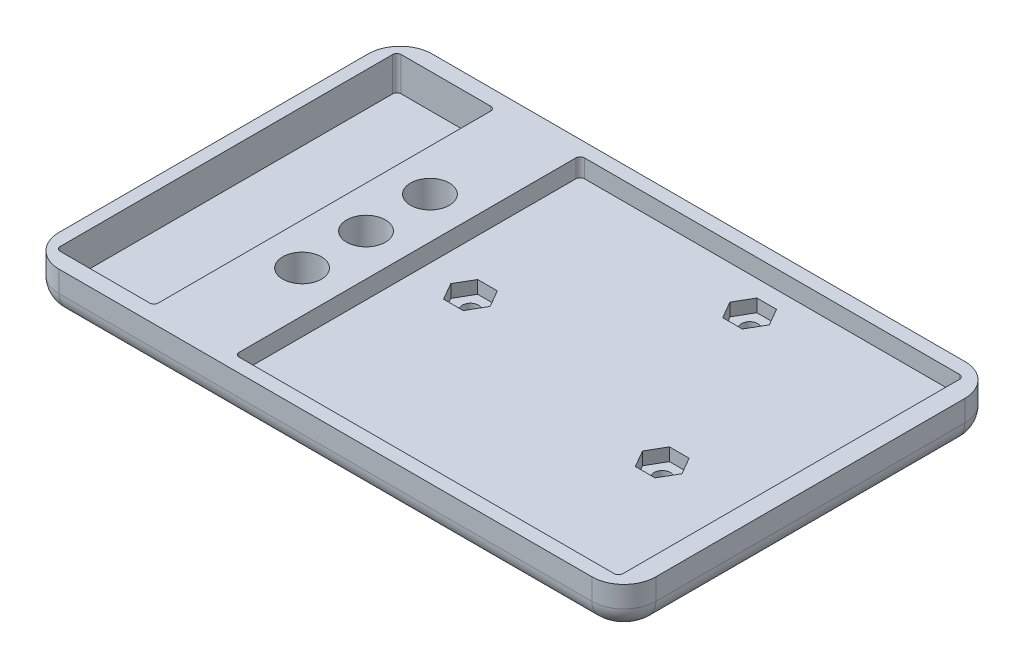
from build123d import *

# Parameters (mm, degrees)
SKETCH1_W             = 140
SKETCH1_H             = 87.5
BOSS_EXTRUDE1_DEPTH   = 10
SKETCH2_W             = 90
SKETCH2_H             = 81
CUT_EXTRUDE1_DEPTH    = 4.25
SKETCH5_W             = 23
SKETCH5_H             = 80
CUT_EXTRUDE2_DEPTH    = 8
F_6_CLEARANCE_HOLE1_D = 3.7973
CUT_EXTRUDE4_DEPTH    = 3
FILLET1_R             = 7.5
SKETCH15_R            = 4.55
CUT_EXTRUDE3_DEPTH    = 7.5
FILLET2_R             = 1
FILLET3_R             = 5


with BuildPart() as part:
    # Sketch1 → Boss-Extrude1 (new body)
    with BuildSketch(Plane(origin=(0, 0, 0), x_dir=(1, 0, 0), z_dir=(0, 1, 0))):
        with Locations((70, 43.75)):
            Rectangle(SKETCH1_W, SKETCH1_H)
    extrude(amount=BOSS_EXTRUDE1_DEPTH)

    # Sketch2 → Cut-Extrude1 (cut)
    with BuildSketch(Plane(origin=(0, 10, 0), x_dir=(1, 0, 0), z_dir=(0, 1, 0))):
        with Locations((90.5, 43.75)):
            Rectangle(SKETCH2_W, SKETCH2_H)
    extrude(amount=-CUT_EXTRUDE1_DEPTH, mode=Mode.SUBTRACT)

    # Sketch5 → Cut-Extrude2 (cut)
    with BuildSketch(Plane(origin=(0, 10, 0), x_dir=(1, 0, 0), z_dir=(0, 1, 0))):
        with Locations((14.5, 43.75)):
            Rectangle(SKETCH5_W, SKETCH5_H)
    extrude(amount=-CUT_EXTRUDE2_DEPTH, mode=Mode.SUBTRACT)

    # #6 Clearance Hole1 (through all)
    with Locations(Plane(origin=(0, 5.75, 0), x_dir=(1, 0, 0), z_dir=(0, 1, 0))):
        with Locations((56.75, 47.25), (93.25, 76.25), (113.25, 35.75)):
            Hole(F_6_CLEARANCE_HOLE1_D / 2)

    # Sketch19 → Cut-Extrude4 (cut)
    with BuildSketch(Plane(origin=(0, 5.75, 0), x_dir=(1, 0, 0), z_dir=(0, 1, 0))):
        Polygon((59.059401077, 51.25), (54.440598923, 51.25), (52.131197846, 47.25), (54.440598923, 43.25), (59.059401077, 43.25), (61.368802154, 47.25), align=None)
        Polygon((97.868802154, 76.25), (95.559401077, 80.25), (90.940598923, 80.25), (88.631197846, 76.25), (90.940598923, 72.25), (95.559401077, 72.25), align=None)
        Polygon((117.868802154, 35.75), (115.559401077, 39.75), (110.940598923, 39.75), (108.631197846, 35.75), (110.940598923, 31.75), (115.559401077, 31.75), align=None)
    extrude(amount=-CUT_EXTRUDE4_DEPTH, mode=Mode.SUBTRACT)

    # Fillet1
    fillet1_edges = [part.edges().sort_by_distance(p)[0] for p in [
        (0, 5, -87.5),
        (140, 5, -87.5),
        (140, 5, 0),
        (0, 5, 0),
    ]]
    fillet(fillet1_edges, radius=FILLET1_R)

    # Sketch15 → Cut-Extrude3 (cut)
    with BuildSketch(Plane(origin=(0, 10, 0), x_dir=(1, 0, 0), z_dir=(0, 1, 0))):
        with Locations(Location((35.75, 43.75, 0), (0, 0, 270))):
            Circle(SKETCH15_R)
        with Locations(Location((35.75, 58.75, 0), (0, 0, 270))):
            Circle(SKETCH15_R)
        with Locations(Location((35.75, 28.75, 0), (0, 0, 270))):
            Circle(SKETCH15_R)
    extrude(amount=-CUT_EXTRUDE3_DEPTH, mode=Mode.SUBTRACT)

    # Fillet2
    fillet2_edges = [part.edges().sort_by_distance(p)[0] for p in [
        (45.5, 7.875, -3.25),
        (45.5, 7.875, -84.25),
        (135.5, 7.875, -84.25),
        (135.5, 7.875, -3.25),
        (3, 6, -3.75),
        (3, 6, -83.75),
        (26, 6, -83.75),
        (26, 6, -3.75),
    ]]
    fillet(fillet2_edges, radius=FILLET2_R)

    # Fillet3
    fillet3_edges = [part.edges().sort_by_distance(p)[0] for p in [
        (70, 0, 0),
        (0, 0, -43.75),
        (70, 0, -87.5),
        (140, 0, -43.75),
        (137.803300859, 0, -2.196699141),
        (137.803300859, 0, -85.303300859),
        (2.196699141, 0, -85.303300859),
        (2.196699141, 0, -2.196699141),
    ]]
    fillet(fillet3_edges, radius=FILLET3_R)


solid = part.part
